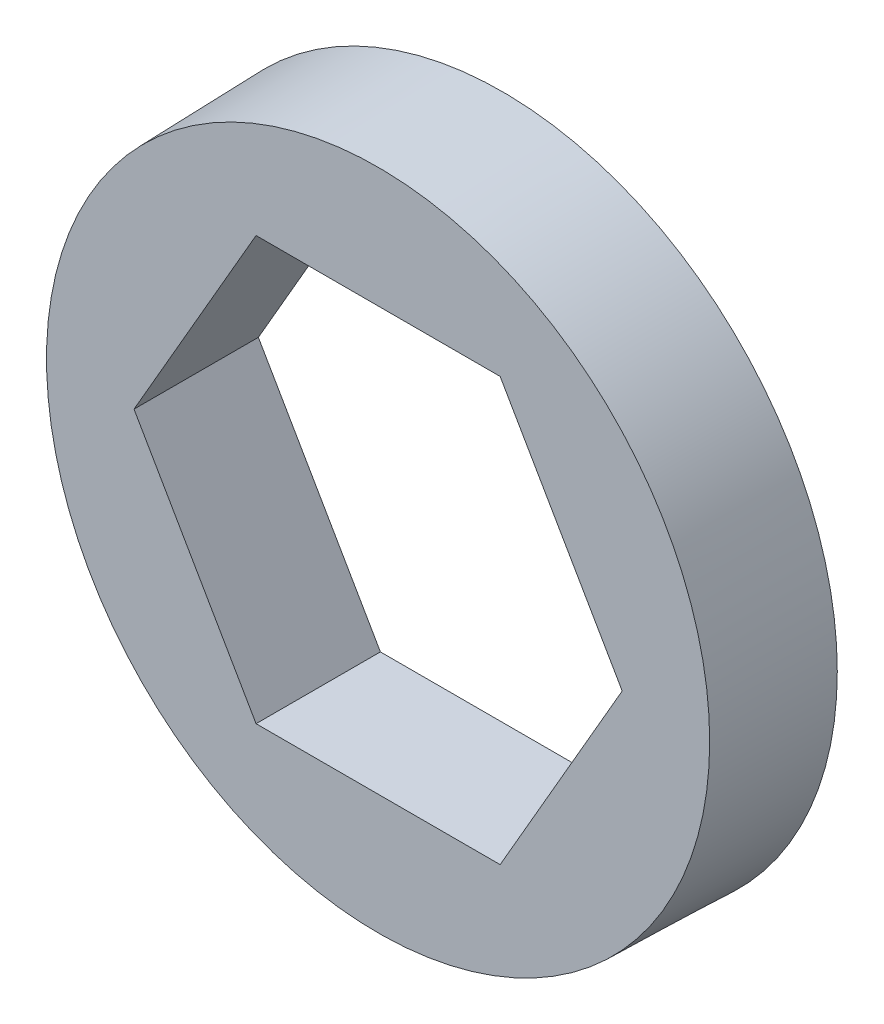
from build123d import *

# Parameters (mm, degrees)
CUT_EXTRUDE1_DEPTH = 6.906060259


with BuildPart() as part:
    # Sketch1 → Revolve1 (revolve)
    with BuildSketch(Plane(origin=(0, 0, 0), x_dir=(1, 0, 0), z_dir=(0, 1, 0))):
        Polygon((4.039278882, 0.75), (0, 0.75), (0, -0.75), (4, -0.75), align=None)
    revolve(axis=Axis((0, 0, -0.75), (0, 0, 1)))

    # Sketch2 → Cut-Extrude1 (cut, through all)
    with BuildSketch(Plane(origin=(0, 0, -0.75), x_dir=(-1, 0, 0), z_dir=(0, 0, -1))):
        Polygon((-2.944486373, 0), (-1.472243186, -2.55), (1.472243186, -2.55), (2.944486373, 0), (1.472243186, 2.55), (-1.472243186, 2.55), align=None)
    extrude(amount=-CUT_EXTRUDE1_DEPTH, mode=Mode.SUBTRACT)


solid = part.part
